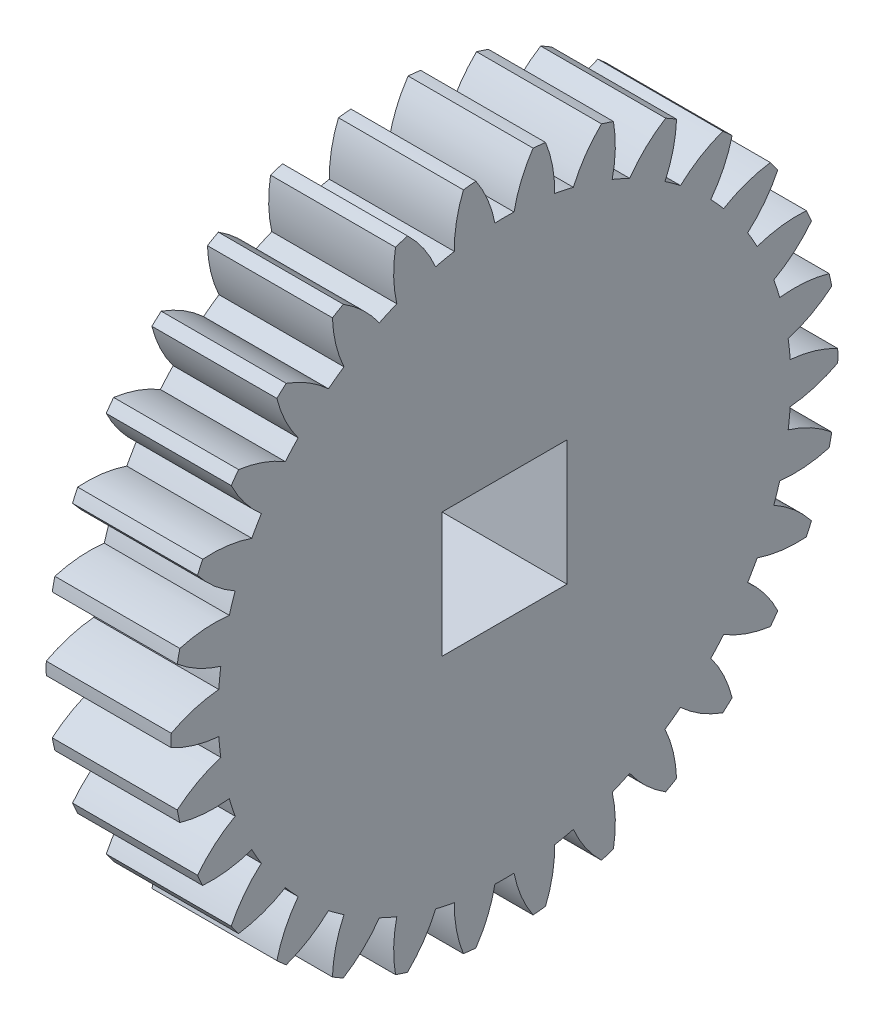
from build123d import *

# Parameters (mm, degrees)
BASPROSKE_W     = 30
BASPROSKE_H     = 80
TOOTHCUT_DEPTH  = 118.046999107
TEETHCUTS_COUNT = 30
TEETHCUTS_ANGLE = 348
BORSKE_W        = 30
BORSKE_H        = 30
BORE_DEPTH      = 50.0000508


with BuildPart() as part:
    # BasProSke → Base-Revolve (revolve)
    with BuildSketch(Plane(origin=(0, 0, 0), x_dir=(1, 0, 0), z_dir=(0, 1, 0)), mode=Mode.PRIVATE) as base_revolve_sk:
        with Locations((15, 40)):
            Rectangle(BASPROSKE_W, BASPROSKE_H)
    revolve(base_revolve_sk.sketch.rotate(Axis((-10, 0, 0), (1, 0, 0)), 180), axis=Axis((-10, 0, 0), (1, 0, 0)))

    # TooCutSke → ToothCut (cut, through all)
    with BuildSketch(Plane(origin=(0, 0, 0), x_dir=(0, 0, -1), z_dir=(1, 0, 0))):
        with BuildLine():
            ThreePointArc((2.295869197, 68.710654091), (0, 68.749), (-2.295869197, 68.710654091))
            ThreePointArc((-2.295869197, 68.710654091), (-4.034057509, 74.450113805), (-6.879070213, 79.729185611))
            ThreePointArc((-6.879070213, 79.729185611), (0, 80.0254), (6.879070213, 79.729185611))
            ThreePointArc((6.879070213, 79.729185611), (4.034057509, 74.450113805), (2.295869197, 68.710654091))
        make_face()
    toothcut = extrude(amount=TOOTHCUT_DEPTH, mode=Mode.SUBTRACT)

    # TeethCuts: ToothCut ×30 about axis
    teethcuts_axis = Axis((-10, 0, 0), (1, 0, 0))
    for i in range(1, TEETHCUTS_COUNT):
        add(toothcut.rotate(teethcuts_axis, i * TEETHCUTS_ANGLE / (TEETHCUTS_COUNT - 1)), mode=Mode.SUBTRACT)

    # BorSke → Bore (cut, symmetric)
    with BuildSketch(Plane(origin=(0, 0, 0), x_dir=(0, 0, -1), z_dir=(1, 0, 0))):
        Rectangle(BORSKE_W, BORSKE_H)
    extrude(amount=BORE_DEPTH, both=True, mode=Mode.SUBTRACT)


solid = part.part
